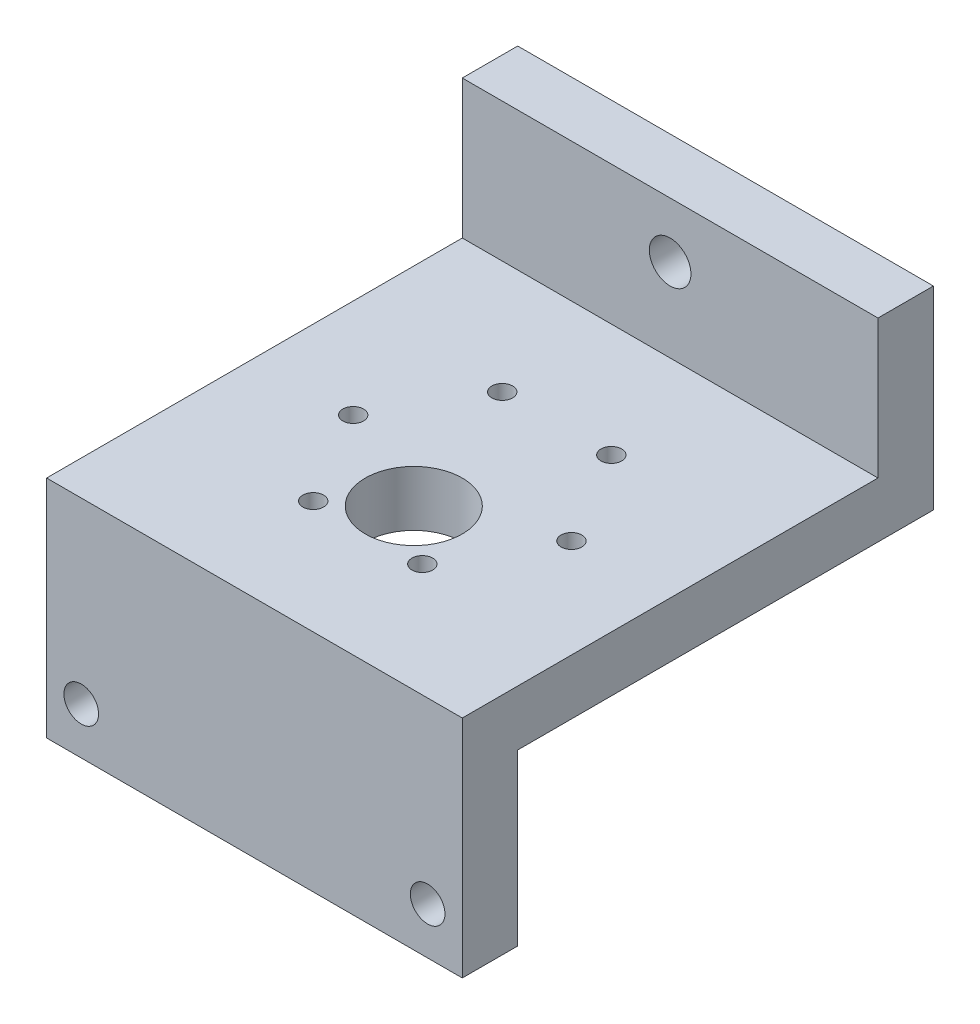
from build123d import *

# Parameters (mm, degrees)
BOSS_EXTRUDE1_DEPTH = 30
SKETCH2_R           = 7
SKETCH2_R_2         = 1.5
CUT_EXTRUDE1_DEPTH  = 55
SKETCH3_R           = 3
CUT_EXTRUDE2_DEPTH  = 55
SKETCH4_W           = 8
SKETCH4_H           = 40
BOSS_EXTRUDE2_DEPTH = 60
SKETCH5_R           = 2.5
CUT_EXTRUDE3_DEPTH  = 10
SKETCH6_W           = 8
SKETCH6_H           = 7.5
CUT_EXTRUDE4_DEPTH  = 94.808315196


with BuildPart() as part:
    # Sketch1 → Boss-Extrude1 (new, symmetric)
    with BuildSketch(Plane(origin=(0, 0, 0), x_dir=(0, 0, -1), z_dir=(1, 0, 0))):
        Polygon((0, 20), (0, 0), (-52, 0), (-52, -8), (8, -8), (8, 20), align=None)
    extrude(amount=BOSS_EXTRUDE1_DEPTH, both=True)

    # Sketch2 → Cut-Extrude1 (cut)
    with BuildSketch(Plane(origin=(0, 0, 0), x_dir=(1, 0, 0), z_dir=(0, 1, 0))):
        with Locations(Location((0, -37, 0), (0, 0, 270))):
            Circle(SKETCH2_R)
        with Locations(Location((15.75, -30, 0), (0, 0, 270))):
            Circle(SKETCH2_R_2)
        with Locations(Location((7.875, -43.63990011, 0), (0, 0, 270))):
            Circle(SKETCH2_R_2)
        with Locations(Location((-7.875, -43.63990011, 0), (0, 0, 270))):
            Circle(SKETCH2_R_2)
        with Locations(Location((-15.75, -30, 0), (0, 0, 270))):
            Circle(SKETCH2_R_2)
        with Locations(Location((-7.875, -16.36009989, 0), (0, 0, 270))):
            Circle(SKETCH2_R_2)
        with Locations(Location((7.875, -16.36009989, 0), (0, 0, 270))):
            Circle(SKETCH2_R_2)
    extrude(amount=-CUT_EXTRUDE1_DEPTH, mode=Mode.SUBTRACT)

    # Sketch3 → Cut-Extrude2 (cut)
    with BuildSketch(Plane.XY):
        with Locations((0, 12)):
            Circle(SKETCH3_R)
    extrude(amount=-CUT_EXTRUDE2_DEPTH, mode=Mode.SUBTRACT)

    # Sketch4 → Boss-Extrude2 (add)
    with BuildSketch(Plane(origin=(30, 0, 0), x_dir=(0, 0, -1), z_dir=(1, 0, 0))):
        with Locations((-56, -20)):
            Rectangle(SKETCH4_W, SKETCH4_H)
    extrude(amount=-BOSS_EXTRUDE2_DEPTH)

    # Sketch5 → Cut-Extrude3 (cut)
    with BuildSketch(Plane.XY.offset(60)):
        with Locations((25, -25.75)):
            Circle(SKETCH5_R)
        with Locations((-25, -25.75)):
            Circle(SKETCH5_R)
    extrude(amount=-CUT_EXTRUDE3_DEPTH, mode=Mode.SUBTRACT)

    # Sketch6 → Cut-Extrude4 (cut, through all)
    with BuildSketch(Plane.ZY.offset(30)):
        with Locations((56, -36.25)):
            Rectangle(SKETCH6_W, SKETCH6_H)
    extrude(amount=-CUT_EXTRUDE4_DEPTH, mode=Mode.SUBTRACT)


solid = part.part
